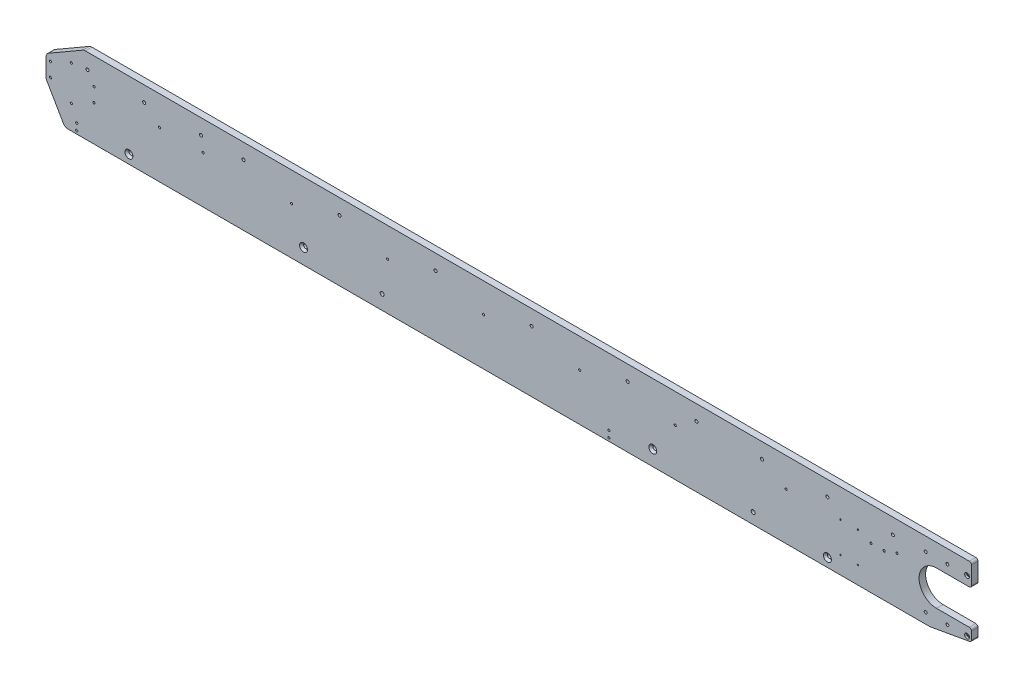
from build123d import *

# Parameters (mm, degrees)
SKIZZE1_R                                            = 2.5
AUFSATZ_LINEAR_AUSTRAGEN1_DEPTH                      = 7.5
M6_GEWINDEBOHRUNG1_D                                 = 5
M8_GEWINDEBOHRUNG1_D                                 = 6.8
FORMSENKUNG_F_R_M8_SENKSCHRAUBE_MIT_2_COUNT          = 2
FORMSENKUNG_F_R_M8_SENKSCHRAUBE_MIT_2_PITCH          = 800
FORMSENKUNG_F_R_M8_SENKSCHRAUBE_MIT_3_COUNT          = 2
FORMSENKUNG_F_R_M8_SENKSCHRAUBE_MIT_3_PITCH          = 1200.093746338
FORMSENKUNG_F_R_M8_SENKSCHRAUBE_MIT_4_COUNT          = 2
FORMSENKUNG_F_R_M8_SENKSCHRAUBE_MIT_4_PITCH          = 400.281151193
F_5_0_5_DURCHMESSER_BOHRUNG1_D                       = 5
STIRNSENKUNG_F_R_M6_ZYLINDERSCHRAUBE_MIT_D           = 6.6
STIRNSENKUNG_F_R_M6_ZYLINDERSCHRAUBE_MIT_CBORE_D     = 11
STIRNSENKUNG_F_R_M6_ZYLINDERSCHRAUBE_MIT_CBORE_DEPTH = 4.4
F_7_0_7_DURCHMESSER_BOHRUNG1_D                       = 7
F_9_0_9_DURCHMESSER_BOHRUNG1_D                       = 9
M6_GEWINDEBOHRUNG2_D                                 = 5
M6_GEWINDEBOHRUNG2_DEPTH                             = 17
M6_GEWINDEBOHRUNG2_TIP                               = 1.502151548
M4_GEWINDEBOHRUNG1_D                                 = 3.3


with BuildPart() as part:
    # Skizze1 → Aufsatz-Linear austragen1 (new, symmetric)
    with BuildSketch(Plane.XY):
        with BuildLine():
            Line((0, 40), (75, 40))
            ThreePointArc((75, 40), (78.535533906, 41.464466094), (80, 45))
            Line((80, 45), (80, 86))
            ThreePointArc((80, 86), (78.535533906, 89.535533906), (75, 91))
            Line((75, 91), (-1949.933358006, 91))
            ThreePointArc((-1949.933358006, 91), (-1953.039186548, 90.591109915), (-1955.933358006, 89.392304845))
            Line((-1955.933358006, 89.392304845), (-2034, 44.320508076))
            ThreePointArc((-2034, 44.320508076), (-2038.392304845, 39.92820323), (-2040, 33.92820323))
            Line((-2040, 33.92820323), (-2040, -5.92820323))
            ThreePointArc((-2040, -5.92820323), (-2039.591109915, -9.034031772), (-2038.392304845, -11.92820323))
            Line((-2038.392304845, -11.92820323), (-2000.245735195, -78))
            ThreePointArc((-2000.245735195, -78), (-1995.853430349, -82.392304845), (-1989.853430349, -84))
            Line((-1989.853430349, -84), (-16.560920831, -84))
            ThreePointArc((-16.560920831, -84), (-15.689363404, -83.961946981), (-14.824439055, -83.84807753))
            Line((-14.824439055, -83.84807753), (75.868240888, -67.856511103))
            ThreePointArc((75.868240888, -67.856511103), (78.830222216, -66.146410387), (80, -62.932472338))
            Line((80, -62.932472338), (80, -45))
            ThreePointArc((80, -45), (78.535533906, -41.464466094), (75, -40))
            Line((75, -40), (0, -40))
            ThreePointArc((0, -40), (-40, 0), (0, 40))
        make_face()
        with Locations((-2030, 30)):
            Circle(SKIZZE1_R, mode=Mode.SUBTRACT)
        with Locations((-1930, -2)):
            Circle(SKIZZE1_R, mode=Mode.SUBTRACT)
    extrude(amount=AUFSATZ_LINEAR_AUSTRAGEN1_DEPTH, both=True)

    # M6 Gewindebohrung1 (through all)
    with Locations(Plane.XY.offset(7.5)):
        with Locations((-120, 14), (-150, 14), (-1930, 30), (-2030, -2), (-1982, 51), (-1982, -29), (-750.5, -77), (-750.5, -62), (-1969.5, -77), (-1969.5, -62)):
            Hole(M6_GEWINDEBOHRUNG1_D / 2)

    # M8 Gewindebohrung1 (through all)
    with Locations(Plane.XY.offset(7.5)):
        with Locations((-24.874423104, -60.052169613), (-24.874423104, 60.052169613), (24.874423104, 60.052169613), (24.874423104, -60.052169613)):
            Hole(M8_GEWINDEBOHRUNG1_D / 2)

    # Skizze4 → Formsenkung für M8 Senkschraube mit Innensechskant1 (revolve, cut)
    with BuildSketch(Plane(origin=(-650, -49, 7.5), x_dir=(0, -1, 0), z_dir=(1, 0, 0))):
        Polygon((0, 0), (0, 15), (9.125, 15), (4.5, 10.375), (4.5, 4.625), (9.125, 0), align=None)
    formsenkung_f_r_m8_senkschraube_mit_inne = revolve(axis=Axis((-650, -49, 13.85), (0, 0, -1)), mode=Mode.SUBTRACT)

    # Formsenkung f_r M8 Senkschraube mit  2: Formsenkung für M8 Senkschraube mit Innensechskant1 ×2
    with Locations(*[(-i * FORMSENKUNG_F_R_M8_SENKSCHRAUBE_MIT_2_PITCH, 0, 0) for i in range(1, FORMSENKUNG_F_R_M8_SENKSCHRAUBE_MIT_2_COUNT)]):
        add(formsenkung_f_r_m8_senkschraube_mit_inne, mode=Mode.SUBTRACT)

    # Formsenkung f_r M8 Senkschraube mit  3: Formsenkung für M8 Senkschraube mit Innensechskant1 ×2
    with Locations(*[Vector(-0.9999218841540816, -0.01249902355192602, 0) * (i * FORMSENKUNG_F_R_M8_SENKSCHRAUBE_MIT_3_PITCH) for i in range(1, FORMSENKUNG_F_R_M8_SENKSCHRAUBE_MIT_3_COUNT)]):
        add(formsenkung_f_r_m8_senkschraube_mit_inne, mode=Mode.SUBTRACT)

    # Formsenkung f_r M8 Senkschraube mit  4: Formsenkung für M8 Senkschraube mit Innensechskant1 ×2
    with Locations(*[Vector(0.9992976157091807, -0.03747366058909428, 0) * (i * FORMSENKUNG_F_R_M8_SENKSCHRAUBE_MIT_4_PITCH) for i in range(1, FORMSENKUNG_F_R_M8_SENKSCHRAUBE_MIT_4_COUNT)]):
        add(formsenkung_f_r_m8_senkschraube_mit_inne, mode=Mode.SUBTRACT)

    # Ø5.0 (5) Durchmesser Bohrung1 (through all)
    with Locations(Plane.XY.offset(7.5)):
        with Locations((-1257.5, 24), (-1780, 24), (-1680, 24), (-1477.5, 24), (-90.5, 24), (-344.5, 24), (-598.5, 24), (-817.5, 24), (-1037.5, 24)):
            Hole(F_5_0_5_DURCHMESSER_BOHRUNG1_D / 2)

    # Stirnsenkung für M6 Zylinderschraube mit Innensechskant1 (through all)
    with Locations(Plane.XY.offset(7.5)):
        with Locations((70, 60), (70, -60)):
            stirnsenkung_f_r_m6_zylinderschraube_mit = CounterBoreHole(STIRNSENKUNG_F_R_M6_ZYLINDERSCHRAUBE_MIT_D / 2, STIRNSENKUNG_F_R_M6_ZYLINDERSCHRAUBE_MIT_CBORE_D / 2, STIRNSENKUNG_F_R_M6_ZYLINDERSCHRAUBE_MIT_CBORE_DEPTH)

    # Spiegeln1: Stirnsenkung für M6 Zylinderschraube mit Innensechskant1 across plane
    add(stirnsenkung_f_r_m6_zylinderschraube_mit.mirror(Plane.XY), mode=Mode.SUBTRACT)

    # Ø7.0 (7) Durchmesser Bohrung1 (through all)
    with Locations(Plane.XY.offset(7.5)):
        with Locations((-100, 56), (-250, 56), (-400, 56), (-550, 56), (-707.5, 56), (-927.5, 56), (-1147.5, 56), (-1367.5, 56), (-1587.5, 56), (-1685, 56), (-1815, 56), (-1945, 56)):
            Hole(F_7_0_7_DURCHMESSER_BOHRUNG1_D / 2)

    # Ø9.0 (9) Durchmesser Bohrung1 (through all)
    with Locations(Plane.XY.offset(7.5)):
        with Locations((-1270, -51), (-420, -59)):
            Hole(F_9_0_9_DURCHMESSER_BOHRUNG1_D / 2)

    # M6 Gewindebohrung2
    with Locations(Plane(origin=(-2040, -1949, 0), x_dir=(0, -1, 0), z_dir=(-1, 0, 0))):
        with Locations((-1960.34820323, 0)):
            Hole(M6_GEWINDEBOHRUNG2_D / 2, depth=M6_GEWINDEBOHRUNG2_DEPTH)
            with Locations((0, 0, -(M6_GEWINDEBOHRUNG2_DEPTH + M6_GEWINDEBOHRUNG2_TIP / 2))):  # 118° drill point
                Cone(0, M6_GEWINDEBOHRUNG2_D / 2, M6_GEWINDEBOHRUNG2_TIP, mode=Mode.SUBTRACT)

    # M4 Gewindebohrung1 (through all)
    with Locations(Plane(origin=(0, 0, -7.5), x_dir=(-1, 0, 0), z_dir=(0, 0, -1))):
        with Locations((180, 26), (220, 26), (220, -44), (180, -44)):
            Hole(M4_GEWINDEBOHRUNG1_D / 2)


solid = part.part
